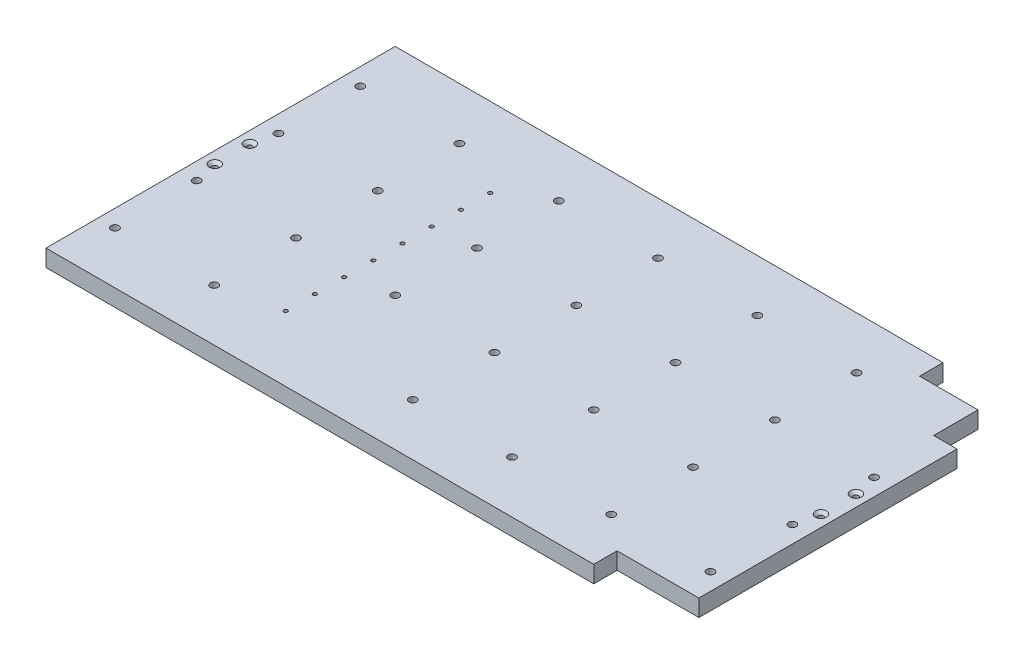
from build123d import *

# Parameters (mm, degrees)
SKETCH1_W                                     = 539
SKETCH1_H                                     = 299
BOSS_EXTRUDE1_DEPTH                           = 14.5
SKETCH22_W                                    = 70
SKETCH22_H                                    = 20
CUT_EXTRUDE9_DEPTH                            = 309.529982336
CUT_EXTRUDE1_DEPTH                            = 6
CSK_FOR_M4_COUNTERSUNK_FLAT_HEAD1_D           = 4.5
CSK_FOR_M4_COUNTERSUNK_FLAT_HEAD1_CSINK_D     = 9.4
CSK_FOR_M4_COUNTERSUNK_FLAT_HEAD1_CSINK_ANGLE = 90
MIRROR2_COPY_1_D                              = 4.5
MIRROR2_COPY_1_CSINK_D                        = 9.4
MIRROR2_COPY_1_CSINK_ANGLE                    = 90
SKETCH11_W                                    = 229
SKETCH11_H                                    = 168
CUT_EXTRUDE4_DEPTH                            = 2.245
SKETCH12_W                                    = 17
SKETCH12_H                                    = 168
BOSS_EXTRUDE2_DEPTH                           = 1.67
M6_CLEARANCE_HOLE1_D                          = 6.6
M4X0_7_TAPPED_HOLE1_D                         = 3.3
LPATTERN1_COUNT                               = 8
LPATTERN1_PITCH                               = 25
CUT_EXTRUDE5_DEPTH                            = 1.5
SKETCH21_W                                    = 20
SKETCH21_H                                    = 1.5
CUT_EXTRUDE8_DEPTH                            = 3.745


with BuildPart() as part:
    # Sketch1 → Boss-Extrude1 (new body)
    with BuildSketch(Plane(origin=(0, 0, 0), x_dir=(1, 0, 0), z_dir=(0, 1, 0))):
        Rectangle(SKETCH1_W, SKETCH1_H)
    extrude(amount=-BOSS_EXTRUDE1_DEPTH)

    # Sketch22 → Cut-Extrude9 (cut, through all)
    with BuildSketch(Plane(origin=(0, 0, 0), x_dir=(1, 0, 0), z_dir=(0, 1, 0))):
        Polygon((269.5, 149.5), (199.5, 149.5), (199.5, 129.5), (249.5, 129.5), (249.5, 91.5), (269.5, 91.5), align=None)
        with Locations((234.5, -139.5)):
            Rectangle(SKETCH22_W, SKETCH22_H)
    extrude(amount=-CUT_EXTRUDE9_DEPTH, mode=Mode.SUBTRACT)

    # Sketch2 → Cut-Extrude1 (cut)
    with BuildSketch(Plane.XZ.offset(14.5)):
        with BuildLine():
            Line((-234.5, -3), (-234.5, -89.5))
            Line((-234.5, -89.5), (-110.5, -89.5))
            Line((-110.5, -89.5), (-110.5, 93.5))
            Line((-110.5, 93.5), (-89, 93.5))
            Line((-89, 93.5), (-89, 128.5))
            Line((-89, 128.5), (178.5, 128.5))
            Line((178.5, 128.5), (178.5, 108.5))
            Line((178.5, 108.5), (228.5, 108.5))
            Line((228.5, 108.5), (228.5, -3))
            Line((228.5, -3), (260, -3))
            ThreePointArc((260, -3), (263, 0), (260, 3))
            Line((260, 3), (234.5, 3))
            Line((234.5, 3), (234.5, 114.5))
            Line((234.5, 114.5), (184.5, 114.5))
            Line((184.5, 114.5), (184.5, 134.5))
            Line((184.5, 134.5), (-95, 134.5))
            Line((-95, 134.5), (-95, 99.5))
            Line((-95, 99.5), (-130, 99.5))
            Line((-130, 99.5), (-130, -83.5))
            Line((-130, -83.5), (-228.5, -83.5))
            Line((-228.5, -83.5), (-228.5, 3))
            Line((-228.5, 3), (-260, 3))
            ThreePointArc((-260, 3), (-263, 0), (-260, -3))
            Line((-260, -3), (-234.5, -3))
        make_face()
    extrude(amount=-CUT_EXTRUDE1_DEPTH, mode=Mode.SUBTRACT)

    # CSK for M4 Countersunk Flat Head1 (through all)
    with Locations(Plane(origin=(-259.5, 0, -15), x_dir=(0, 0, 1), z_dir=(0, 1, 0))):
        with Locations((0, 0)):
            csk_for_m4_countersunk_flat_head1 = CounterSinkHole(CSK_FOR_M4_COUNTERSUNK_FLAT_HEAD1_D / 2, CSK_FOR_M4_COUNTERSUNK_FLAT_HEAD1_CSINK_D / 2, counter_sink_angle=CSK_FOR_M4_COUNTERSUNK_FLAT_HEAD1_CSINK_ANGLE)

    # Mirror1: CSK for M4 Countersunk Flat Head1 across plane
    add(csk_for_m4_countersunk_flat_head1.mirror(Plane.XY), mode=Mode.SUBTRACT)

    # Mirror2: CSK for M4 Countersunk Flat Head1 across plane
    add(csk_for_m4_countersunk_flat_head1.mirror(Plane(origin=(0, 0, 0), x_dir=(0, 0, 1), z_dir=(1, 0, 0))), mode=Mode.SUBTRACT)

    # Mirror2 copy 1 (through all)
    with Locations(Plane(origin=(259.5, 0, 15), x_dir=(0, 0, -1), z_dir=(0, 1, 0))):
        with Locations((0, 0)):
            CounterSinkHole(MIRROR2_COPY_1_D / 2, MIRROR2_COPY_1_CSINK_D / 2, counter_sink_angle=MIRROR2_COPY_1_CSINK_ANGLE)

    # Sketch11 → Cut-Extrude4 (cut)
    with BuildSketch(Plane.XZ.offset(14.5)):
        with Locations((14, 0)):
            Rectangle(SKETCH11_W, SKETCH11_H)
    extrude(amount=-CUT_EXTRUDE4_DEPTH, mode=Mode.SUBTRACT)

    # Sketch12 → Boss-Extrude2 (add)
    with BuildSketch(Plane.XZ.offset(12.255)):
        with Locations((-92, 0)):
            Rectangle(SKETCH12_W, SKETCH12_H)
    extrude(amount=BOSS_EXTRUDE2_DEPTH)

    # M6 Clearance Hole1 (through all)
    with Locations(Plane(origin=(-255, 0, -105), x_dir=(0, 0, 1), z_dir=(0, 1, 0))):
        with Locations((0, 0), (70, 0), (140, 0), (210, 0), (210, 85), (140, 85), (70, 85), (0, 85), (0, 170), (0, 255), (0, 340), (0, 425), (70, 510), (140, 510), (210, 510), (210, 425), (140, 425), (70, 425), (210, 340), (210, 255), (140, 255), (70, 255), (70, 340), (140, 340), (140, 170), (70, 170)):
            Hole(M6_CLEARANCE_HOLE1_D / 2)

    # M4x0.7 Tapped Hole1 (through all)
    with Locations(Plane(origin=(-120.25, -8.5, -81.5), x_dir=(0, 0, -1), z_dir=(0, -1, 0))):
        with Locations((0, 0)):
            m4x0_7_tapped_hole1 = Hole(M4X0_7_TAPPED_HOLE1_D / 2)

    # LPattern1: M4x0.7 Tapped Hole1 ×8
    with Locations(*[(0, 0, i * LPATTERN1_PITCH) for i in range(1, LPATTERN1_COUNT)]):
        add(m4x0_7_tapped_hole1, mode=Mode.SUBTRACT)

    # Sketch20 → Cut-Extrude5 (cut)
    with BuildSketch(Plane.XZ.offset(12.255)):
        Polygon((-63.5, -84), (-83.5, -84), (-83.5, -10), (-83.5, 10), (-83.5, 84), (-63.5, 84), (-63.5, 10), (-40.5, 10), (-40.5, 84), (-20.5, 84), (-20.5, 10), (12.5, 10), (12.5, 84), (32.5, 84), (32.5, 10), (65.5, 10), (65.5, 84), (85.5, 84), (85.5, 10), (108.5, 10), (108.5, 84), (128.5, 84), (128.5, -84), (108.5, -84), (108.5, -10), (85.5, -10), (85.5, -84), (65.5, -84), (65.5, -10), (32.5, -10), (32.5, -84), (12.5, -84), (12.5, -10), (-20.5, -10), (-20.5, -84), (-40.5, -84), (-40.5, -10), (-63.5, -10), align=None)
    extrude(amount=-CUT_EXTRUDE5_DEPTH, mode=Mode.SUBTRACT)

    # Sketch21 → Cut-Extrude8 (cut)
    with BuildSketch(Plane.XZ.offset(14.5)):
        with Locations((-73.5, -84.75)):
            Rectangle(SKETCH21_W, SKETCH21_H)
        with Locations((-30.5, -84.75)):
            Rectangle(SKETCH21_W, SKETCH21_H)
        with Locations((22.5, -84.75)):
            Rectangle(SKETCH21_W, SKETCH21_H)
        with Locations((75.5, -84.75)):
            Rectangle(SKETCH21_W, SKETCH21_H)
        with Locations((118.5, -84.75)):
            Rectangle(SKETCH21_W, SKETCH21_H)
    extrude(amount=-CUT_EXTRUDE8_DEPTH, mode=Mode.SUBTRACT)


solid = part.part
